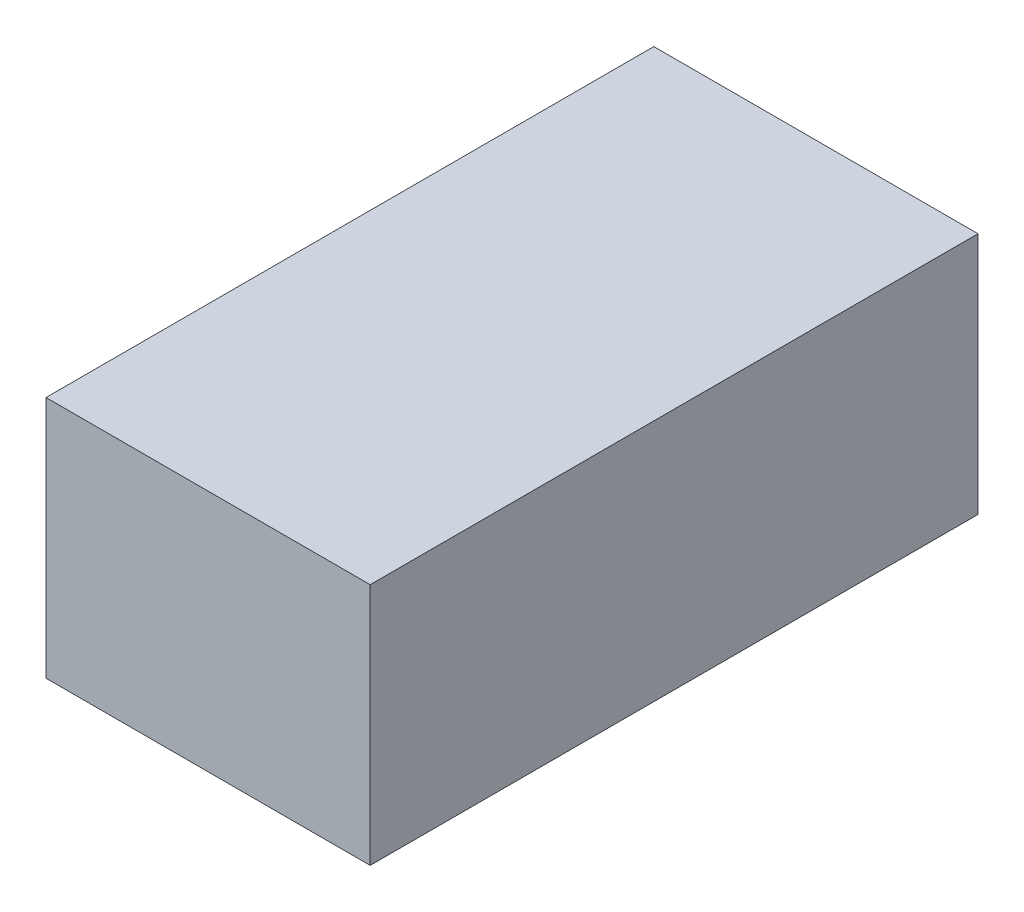
from build123d import *

# Parameters (mm, degrees)
SKETCH1_W           = 15
SKETCH1_H           = 6
BOSS_EXTRUDE1_DEPTH = 4


with BuildPart() as part:
    # Sketch1 → Boss-Extrude1 (new, symmetric)
    with BuildSketch(Plane(origin=(0, 0, 0), x_dir=(0, 0, -1), z_dir=(1, 0, 0))):
        Rectangle(SKETCH1_W, SKETCH1_H)
    extrude(amount=BOSS_EXTRUDE1_DEPTH, both=True)


solid = part.part
